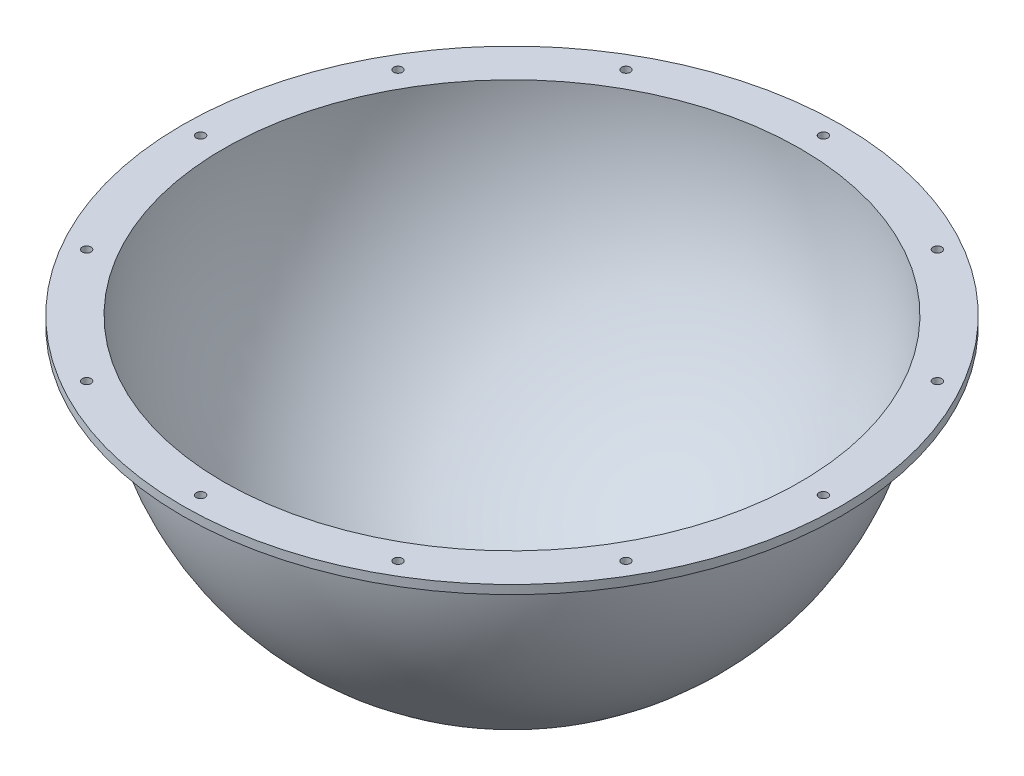
from build123d import *

# Parameters (mm, degrees)
REVOLVE1_ANGLE     = 180
SKETCH10_R         = 6
CUT_EXTRUDE1_DEPTH = 752.664818919


with BuildPart() as part:
    # Sketch1 → Revolve1 (revolve)
    with BuildSketch(Plane(origin=(0, 0, 0), x_dir=(1, 0, 0), z_dir=(0, 1, 0))):
        with BuildLine():
            Line((0, 400), (0, 393.75))
            ThreePointArc((0, 393.75), (-393.75, 0), (0, -393.75))
            Line((0, -393.75), (0, -400))
            ThreePointArc((0, -400), (-400, 0), (0, 400))
        make_face()
    revolve(axis=Axis((0, 0, -400), (0, 0, 1)), revolution_arc=REVOLVE1_ANGLE)

    # Sketch3 → Revolve2 (revolve)
    with BuildSketch(Plane(origin=(0, 0, 0), x_dir=(0, 0, -1), z_dir=(1, 0, 0)), mode=Mode.PRIVATE) as revolve2_sk:
        with BuildLine():
            Line((-400, 0), (-450, 0))
            Line((-450, 0), (-450, -12))
            Line((-450, -12), (-399.819959482, -12))
            ThreePointArc((-399.819959482, -12), (-399.954987338, -6.000675266), (-400, 0))
        make_face()
    revolve(revolve2_sk.sketch.rotate(Axis((0, 0, 0), (0, 1, 0)), 180), axis=Axis((0, 0, 0), (0, 1, 0)))

    # Sketch10 → Cut-Extrude1 (cut, through all)
    with BuildSketch(Plane(origin=(0, 0, 0), x_dir=(1, 0, 0), z_dir=(0, 1, 0))):
        with Locations(Location((0, 425, 0), (0, 0, 180))):
            Circle(SKETCH10_R)
        with Locations(Location((-212.5, 368.060796608, 0), (0, 0, 180))):
            Circle(SKETCH10_R)
        with Locations(Location((-368.060796608, 212.5, 0), (0, 0, 180))):
            Circle(SKETCH10_R)
        with Locations(Location((-425, 0, 0), (0, 0, 180))):
            Circle(SKETCH10_R)
        with Locations(Location((-368.060796608, -212.5, 0), (0, 0, 180))):
            Circle(SKETCH10_R)
        with Locations(Location((-212.5, -368.060796608, 0), (0, 0, 180))):
            Circle(SKETCH10_R)
        with Locations(Location((0, -425, 0), (0, 0, 180))):
            Circle(SKETCH10_R)
        with Locations(Location((212.5, -368.060796608, 0), (0, 0, 180))):
            Circle(SKETCH10_R)
        with Locations(Location((368.060796608, -212.5, 0), (0, 0, 180))):
            Circle(SKETCH10_R)
        with Locations(Location((425, 0, 0), (0, 0, 180))):
            Circle(SKETCH10_R)
        with Locations(Location((368.060796608, 212.5, 0), (0, 0, 180))):
            Circle(SKETCH10_R)
        with Locations(Location((212.5, 368.060796608, 0), (0, 0, 180))):
            Circle(SKETCH10_R)
    extrude(amount=-CUT_EXTRUDE1_DEPTH, mode=Mode.SUBTRACT)


solid = part.part
